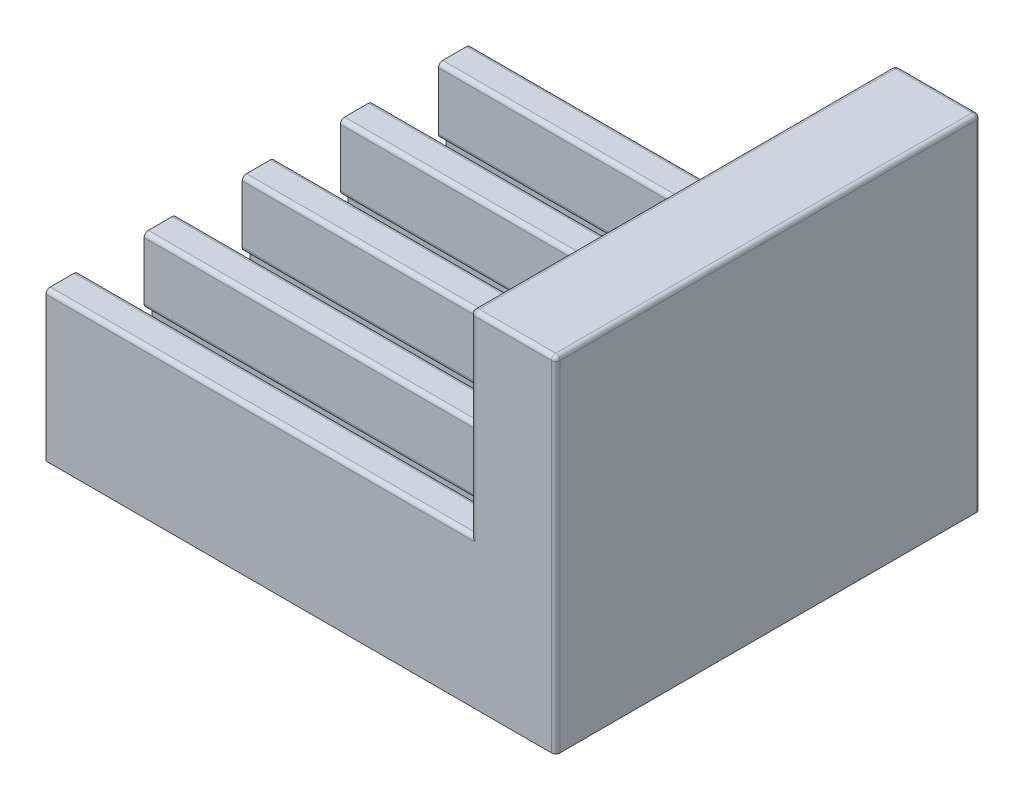
from build123d import *

# Parameters (mm, degrees)
SKETCH1_W           = 120
SKETCH1_H           = 100
BOSS_EXTRUDE1_DEPTH = 81
SKETCH2_W           = 100
SKETCH2_H           = 100
CUT_EXTRUDE1_DEPTH  = 46
SKETCH6_W           = 15.5
SKETCH6_H           = 15.5
CUT_EXTRUDE4_DEPTH  = 100
SKETCH8_W           = 19.1
SKETCH8_H           = 10
CUT_EXTRUDE5_DEPTH  = 100
SKETCH6_3_R         = 5.95
CUT_EXTRUDE6_DEPTH  = 111
FILLET1_R           = 1
CHAMFER1_SIZE       = 1
FILLET2_R           = 1
FILLET3_R           = 1


with BuildPart() as part:
    # Sketch1 → Boss-Extrude1 (new body)
    with BuildSketch(Plane(origin=(0, 0, 0), x_dir=(1, 0, 0), z_dir=(0, 1, 0))):
        with Locations((-3.53539823, -7.581858407)):
            Rectangle(SKETCH1_W, SKETCH1_H)
    extrude(amount=BOSS_EXTRUDE1_DEPTH)

    # Sketch2 → Cut-Extrude1 (cut)
    with BuildSketch(Plane(origin=(0, 81, 0), x_dir=(1, 0, 0), z_dir=(0, 1, 0))):
        with Locations((-13.53539823, -7.581858407)):
            Rectangle(SKETCH2_W, SKETCH2_H)
    extrude(amount=-CUT_EXTRUDE1_DEPTH, mode=Mode.SUBTRACT)

    # Sketch6 → Cut-Extrude4 (cut)
    with BuildSketch(Plane.ZY.offset(63.53539823)):
        with Locations((-27.068141593, 27.25)):
            Rectangle(SKETCH6_W, SKETCH6_H)
        with Locations((-3.968141593, 27.25)):
            Rectangle(SKETCH6_W, SKETCH6_H)
        with Locations((19.131858407, 27.25)):
            Rectangle(SKETCH6_W, SKETCH6_H)
        with Locations((42.231858407, 27.25)):
            Rectangle(SKETCH6_W, SKETCH6_H)
    extrude(amount=-CUT_EXTRUDE4_DEPTH, mode=Mode.SUBTRACT)

    # Sketch8 → Cut-Extrude5 (cut)
    with BuildSketch(Plane.ZY.offset(63.53539823)):
        with Locations((-27.068141593, 14.5)):
            Rectangle(SKETCH8_W, SKETCH8_H)
        with Locations((-3.968141593, 14.5)):
            Rectangle(SKETCH8_W, SKETCH8_H)
        with Locations((42.231858407, 14.5)):
            Rectangle(SKETCH8_W, SKETCH8_H)
        with Locations((19.131858407, 14.5)):
            Rectangle(SKETCH8_W, SKETCH8_H)
    extrude(amount=-CUT_EXTRUDE5_DEPTH, mode=Mode.SUBTRACT)

    # Sketch6<3> → Cut-Extrude6 (cut)
    with BuildSketch(Plane.ZY.offset(63.53539823)):
        with Locations((-27.068141593, 27.25)):
            Circle(SKETCH6_3_R)
        with Locations((-3.968141593, 27.25)):
            Circle(SKETCH6_3_R)
        with Locations((42.231858407, 27.25)):
            Circle(SKETCH6_3_R)
        with Locations((19.131858407, 27.25)):
            Circle(SKETCH6_3_R)
    extrude(amount=-CUT_EXTRUDE6_DEPTH, mode=Mode.SUBTRACT)

    # Fillet1
    fillet1_edges = [part.edges().sort_by_distance(p)[0] for p in [
        (-13.53539823, 35, -42.418141593),
        (-13.53539823, 35, 57.581858407),
        (36.46460177, 58, -42.418141593),
        (36.46460177, 58, 57.581858407),
        (46.46460177, 81, 57.581858407),
        (36.46460177, 81, 7.581858407),
        (46.46460177, 81, -42.418141593),
        (56.46460177, 81, 7.581858407),
        (56.46460177, 40.5, 57.581858407),
        (56.46460177, 40.5, -42.418141593),
    ]]
    fillet(fillet1_edges, radius=FILLET1_R)

    # Chamfer1
    chamfer1_edges = [part.edges().sort_by_distance(p)[0] for p in [
        (36.46460177, 27.25, 36.281858407),
        (36.46460177, 27.25, 13.181858407),
        (36.46460177, 27.25, -9.918141593),
        (36.46460177, 27.25, -33.018141593),
    ]]
    chamfer(chamfer1_edges, length=CHAMFER1_SIZE)

    # Fillet2
    fillet2_edges = [part.edges().sort_by_distance(p)[0] for p in [
        (47.46460177, 27.25, 36.281858407),
        (47.46460177, 27.25, 13.181858407),
        (47.46460177, 27.25, -9.918141593),
        (47.46460177, 27.25, -33.018141593),
    ]]
    fillet(fillet2_edges, radius=FILLET2_R)

    # Fillet3
    fillet3_edges = [part.edges().sort_by_distance(p)[0] for p in [
        (-13.53539823, 19.5, -19.318141593),
        (-13.53539823, 19.5, 3.781858407),
        (-13.53539823, 19.5, 26.881858407),
        (-13.53539823, 19.5, -34.818141593),
        (-13.53539823, 19.5, -11.718141593),
        (-13.53539823, 19.5, 11.381858407),
        (-13.53539823, 19.5, 34.481858407),
        (-13.53539823, 19.5, 49.981858407),
        (-13.53539823, 35, -34.818141593),
        (-13.53539823, 35, -19.318141593),
        (-13.53539823, 35, -11.718141593),
        (-13.53539823, 35, 3.781858407),
        (-13.53539823, 35, 26.881858407),
        (-13.53539823, 35, 11.381858407),
        (-13.53539823, 35, 34.481858407),
        (-13.53539823, 35, 49.981858407),
    ]]
    fillet(fillet3_edges, radius=FILLET3_R)


solid = part.part
